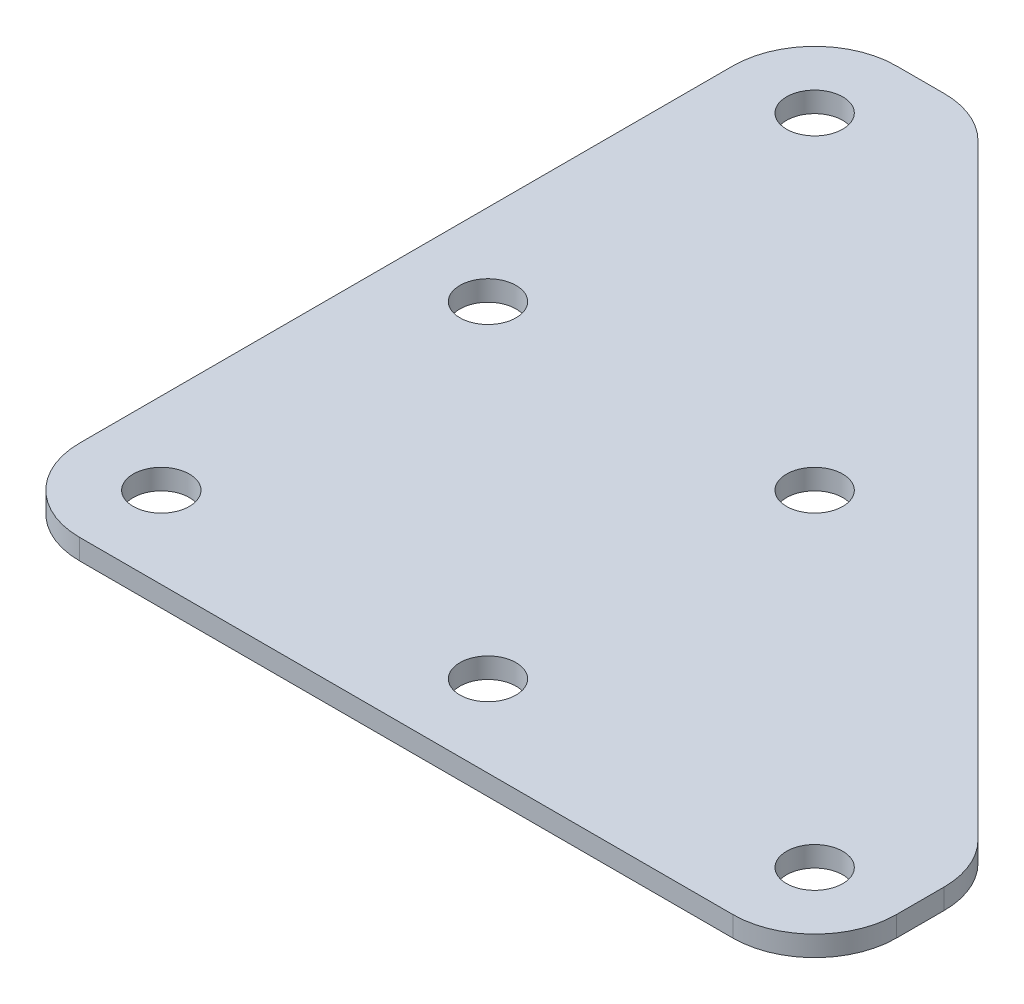
from build123d import *

# Parameters (mm, degrees)
SKETCH1_R           = 2.1828125
BOSS_EXTRUDE1_DEPTH = 0.79375


with BuildPart() as part:
    # Sketch1 → Boss-Extrude1 (new, symmetric)
    with BuildSketch(Plane(origin=(0, 0, 0), x_dir=(1, 0, 0), z_dir=(0, 1, 0))):
        with BuildLine():
            Line((-6.35, 0), (-6.35, 50.8))
            ThreePointArc((-6.35, 50.8), (-4.490128061, 55.290128061), (0, 57.15))
            Line((0, 57.15), (3.719743879, 57.15))
            ThreePointArc((3.719743879, 57.15), (6.149783674, 56.666635031), (8.209871939, 55.290128061))
            Line((8.209871939, 55.290128061), (55.290128061, 8.209871939))
            ThreePointArc((55.290128061, 8.209871939), (56.666635031, 6.149783674), (57.15, 3.719743879))
            Line((57.15, 3.719743879), (57.15, 0))
            ThreePointArc((57.15, 0), (55.290128061, -4.490128061), (50.8, -6.35))
            Line((50.8, -6.35), (0, -6.35))
            ThreePointArc((0, -6.35), (-4.490128061, -4.490128061), (-6.35, 0))
        make_face()
        with Locations(Location((0, 0, 0), (0, 0, 270))):
            Circle(SKETCH1_R, mode=Mode.SUBTRACT)
        with Locations(Location((0, 50.8, 0), (0, 0, 270))):
            Circle(SKETCH1_R, mode=Mode.SUBTRACT)
        with Locations(Location((50.8, 0, 0), (0, 0, 270))):
            Circle(SKETCH1_R, mode=Mode.SUBTRACT)
        with Locations(Location((25.4, 0, 0), (0, 0, 270))):
            Circle(SKETCH1_R, mode=Mode.SUBTRACT)
        with Locations(Location((0, 25.4, 0), (0, 0, 270))):
            Circle(SKETCH1_R, mode=Mode.SUBTRACT)
        with Locations(Location((25.4, 25.4, 0), (0, 0, 270))):
            Circle(SKETCH1_R, mode=Mode.SUBTRACT)
    extrude(amount=BOSS_EXTRUDE1_DEPTH, both=True)


solid = part.part
